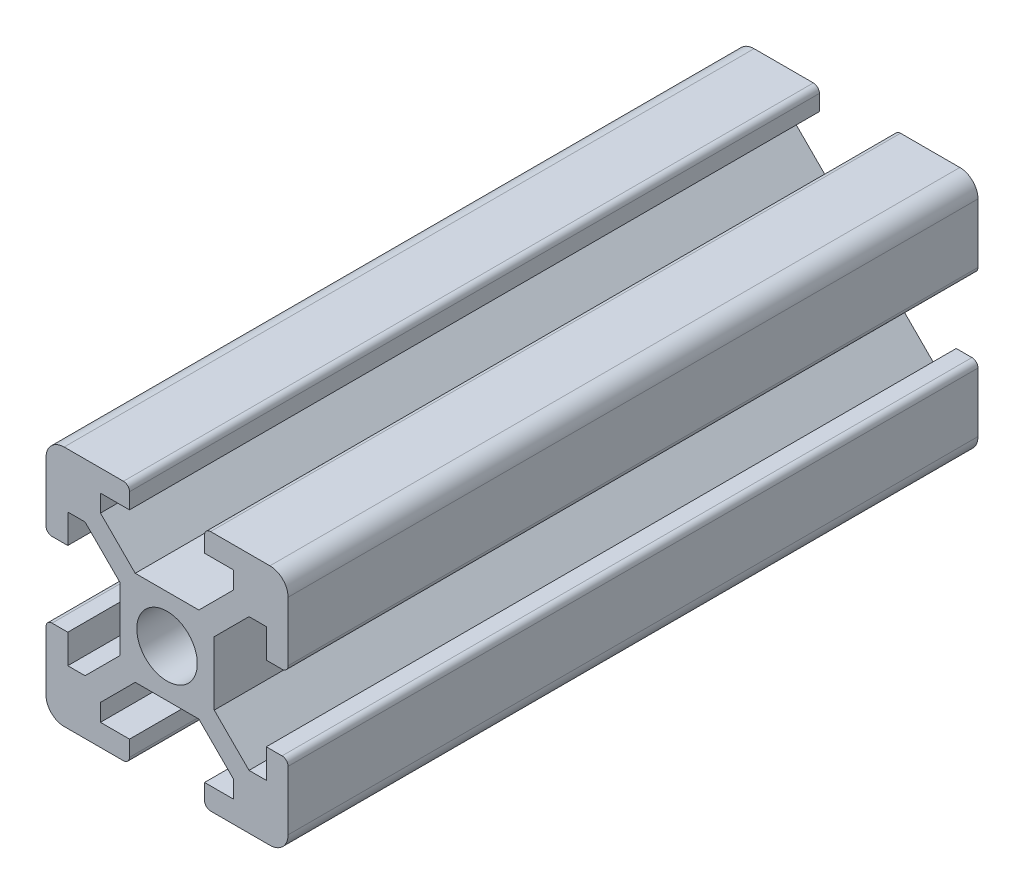
from build123d import *

# Parameters (mm, degrees)
SKETCH_1_R      = 2.5
EXTRUDE_1_DEPTH = 57
FILLET_1_R      = 1.5
FILLET_2_R      = 1.5
FILLET_3_R      = 1.5
FILLET_4_R      = 1.5
FILLET_5_R      = 0.5
FILLET_6_R      = 0.5
FILLET_7_R      = 0.5
FILLET_8_R      = 0.5
FILLET_9_R      = 0.5
FILLET_10_R     = 0.5
FILLET_11_R     = 0.5
FILLET_12_R     = 0.5


with BuildPart() as part:
    # 草图1 → 凸台-拉伸1 (new body)
    with BuildSketch(Plane.XY):
        Polygon((0, 6.9), (0, 0), (6.9, 0), (6.9, 1.8), (4.5, 1.8), (4.5, 3.227207794), (7.372792206, 6.1), (12.627207794, 6.1), (15.5, 3.227207794), (15.5, 1.8), (13.1, 1.8), (13.1, 0), (20, 0), (20, 6.9), (18.2, 6.9), (18.2, 4.5), (16.772792206, 4.5), (13.9, 7.372792206), (13.9, 12.627207794), (16.772792206, 15.5), (18.2, 15.5), (18.2, 13.1), (20, 13.1), (20, 20), (13.1, 20), (13.1, 18.2), (15.5, 18.2), (15.5, 16.772792206), (12.627207794, 13.9), (7.372792206, 13.9), (4.5, 16.772792206), (4.5, 18.2), (6.9, 18.2), (6.9, 20), (0, 20), (0, 13.1), (1.8, 13.1), (1.8, 15.5), (3.227207794, 15.5), (6.1, 12.627207794), (6.1, 7.372792206), (3.227207794, 4.5), (1.8, 4.5), (1.8, 6.9), align=None)
        with Locations(Location((10, 10, 0), (0, 0, 180))):
            Circle(SKETCH_1_R, mode=Mode.SUBTRACT)
    extrude(amount=EXTRUDE_1_DEPTH)

    # 圆角1
    fillet_1_edges = [part.edges().sort_by_distance(p)[0] for p in [
        (20, 20, 28.5),
    ]]
    fillet(fillet_1_edges, radius=FILLET_1_R)

    # 圆角2
    fillet_2_edges = [part.edges().sort_by_distance(p)[0] for p in [
        (0, 20, 28.5),
    ]]
    fillet(fillet_2_edges, radius=FILLET_2_R)

    # 圆角3
    fillet_3_edges = [part.edges().sort_by_distance(p)[0] for p in [
        (0, 0, 28.5),
    ]]
    fillet(fillet_3_edges, radius=FILLET_3_R)

    # 圆角4
    fillet_4_edges = [part.edges().sort_by_distance(p)[0] for p in [
        (20, 0, 28.5),
    ]]
    fillet(fillet_4_edges, radius=FILLET_4_R)

    # 圆角5
    fillet_5_edges = [part.edges().sort_by_distance(p)[0] for p in [
        (13.1, 20, 28.5),
    ]]
    fillet(fillet_5_edges, radius=FILLET_5_R)

    # 圆角6
    fillet_6_edges = [part.edges().sort_by_distance(p)[0] for p in [
        (6.9, 20, 28.5),
    ]]
    fillet(fillet_6_edges, radius=FILLET_6_R)

    # 圆角7
    fillet_7_edges = [part.edges().sort_by_distance(p)[0] for p in [
        (0, 13.1, 28.5),
    ]]
    fillet(fillet_7_edges, radius=FILLET_7_R)

    # 圆角8
    fillet_8_edges = [part.edges().sort_by_distance(p)[0] for p in [
        (0, 6.9, 28.5),
    ]]
    fillet(fillet_8_edges, radius=FILLET_8_R)

    # 圆角9
    fillet_9_edges = [part.edges().sort_by_distance(p)[0] for p in [
        (6.9, 0, 28.5),
    ]]
    fillet(fillet_9_edges, radius=FILLET_9_R)

    # 圆角10
    fillet_10_edges = [part.edges().sort_by_distance(p)[0] for p in [
        (13.1, 0, 28.5),
    ]]
    fillet(fillet_10_edges, radius=FILLET_10_R)

    # 圆角11
    fillet_11_edges = [part.edges().sort_by_distance(p)[0] for p in [
        (20, 13.1, 28.5),
    ]]
    fillet(fillet_11_edges, radius=FILLET_11_R)

    # 圆角12
    fillet_12_edges = [part.edges().sort_by_distance(p)[0] for p in [
        (20, 6.9, 28.5),
    ]]
    fillet(fillet_12_edges, radius=FILLET_12_R)


solid = part.part
